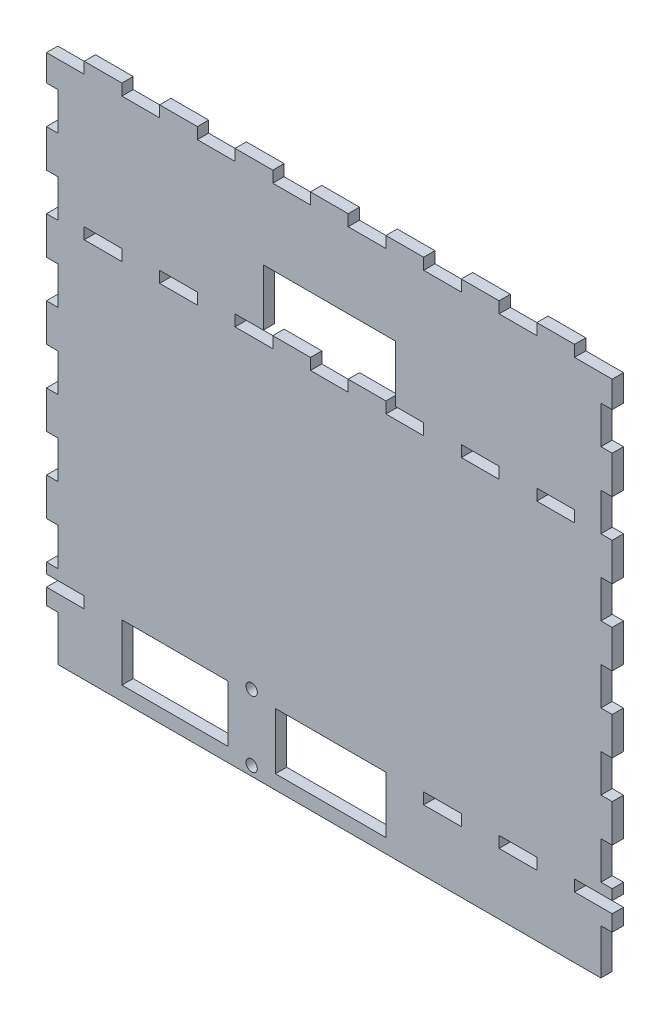
from build123d import *

# Parameters (mm, degrees)
CROQUIS1_W              = 10
CROQUIS1_H              = 3
CROQUIS1_W_2            = 28.1
CROQUIS1_H_2            = 15
CROQUIS1_R              = 1.5
CROQUIS1_W_3            = 29.3
SALIENTE_EXTRUIR3_DEPTH = 3


with BuildPart() as part:
    # Croquis1 → Saliente-Extruir3 (new body)
    with BuildSketch(Plane.XY):
        Polygon((-35, 72.5), (-45, 72.5), (-45, 69.5), (-55, 69.5), (-55, 72.5), (-65, 72.5), (-65, 69.5), (-75, 69.5), (-75, 62.5), (-72, 62.5), (-72, 52.5), (-75, 52.5), (-75, 42.5), (-72, 42.5), (-72, 32.5), (-75, 32.5), (-75, 22.5), (-72, 22.5), (-72, 12.5), (-75, 12.5), (-75, 2.5), (-72, 2.5), (-72, -7.5), (-75, -7.5), (-75, -17.5), (-72, -17.5), (-72, -27.5), (-75, -27.5), (-75, -37.5), (-72, -37.5), (-72, -47.5), (-75, -47.5), (-75, -50.25), (-65, -50.25), (-65, -53.25), (-75, -53.25), (-75, -57.5), (-72, -57.5), (-72, -69.5), (72, -69.5), (72, -57.5), (75, -57.5), (75, -53.25), (65, -53.25), (65, -50.25), (75, -50.25), (75, -47.5), (72, -47.5), (72, -37.5), (75, -37.5), (75, -27.5), (72, -27.5), (72, -17.5), (75, -17.5), (75, -7.5), (72, -7.5), (72, 2.5), (75, 2.5), (75, 12.5), (72, 12.5), (72, 22.5), (75, 22.5), (75, 32.5), (72, 32.5), (72, 42.5), (75, 42.5), (75, 52.5), (72, 52.5), (72, 62.5), (75, 62.5), (75, 69.5), (65, 69.5), (65, 72.5), (55, 72.5), (55, 69.5), (45, 69.5), (45, 72.5), (35, 72.5), (35, 69.5), (25, 69.5), (25, 72.5), (15, 72.5), (15, 69.5), (5, 69.5), (5, 72.5), (-5, 72.5), (-5, 69.5), (-15, 69.5), (-15, 72.5), (-25, 72.5), (-25, 69.5), (-35, 69.5), align=None)
        with Locations((60, 33)):
            Rectangle(CROQUIS1_W, CROQUIS1_H, mode=Mode.SUBTRACT)
        with Locations((-40.95, -58.25)):
            Rectangle(CROQUIS1_W_2, CROQUIS1_H_2, mode=Mode.SUBTRACT)
        with Locations((-20.6, -67)):
            Circle(CROQUIS1_R, mode=Mode.SUBTRACT)
        with Locations((-20.6, -49.5)):
            Circle(CROQUIS1_R, mode=Mode.SUBTRACT)
        with Locations((0.35, -58.25)):
            Rectangle(CROQUIS1_W_3, CROQUIS1_H_2, mode=Mode.SUBTRACT)
        with Locations((30, -51.75)):
            Rectangle(CROQUIS1_W, CROQUIS1_H, mode=Mode.SUBTRACT)
        with Locations((50, -51.75)):
            Rectangle(CROQUIS1_W, CROQUIS1_H, mode=Mode.SUBTRACT)
        with Locations((-60, 33)):
            Rectangle(CROQUIS1_W, CROQUIS1_H, mode=Mode.SUBTRACT)
        with Locations((-40, 33)):
            Rectangle(CROQUIS1_W, CROQUIS1_H, mode=Mode.SUBTRACT)
        Polygon((-25, 31.5), (-25, 34.5), (-17.5, 34.5), (-17.5, 49.5), (17.5, 49.5), (17.5, 34.5), (25, 34.5), (25, 31.5), (15, 31.5), (15, 34.5), (5, 34.5), (5, 31.5), (-5, 31.5), (-5, 34.5), (-15, 34.5), (-15, 31.5), align=None, mode=Mode.SUBTRACT)
        with Locations((40, 33)):
            Rectangle(CROQUIS1_W, CROQUIS1_H, mode=Mode.SUBTRACT)
    extrude(amount=SALIENTE_EXTRUIR3_DEPTH)


solid = part.part
